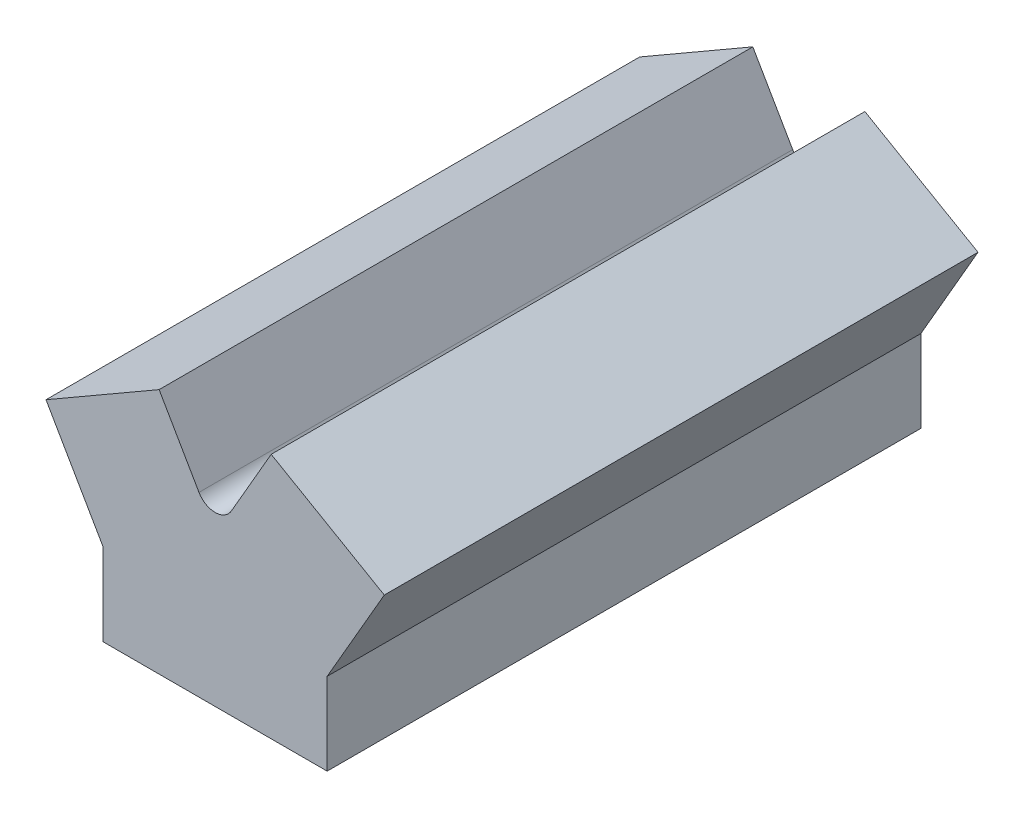
from build123d import *

# Parameters (mm, degrees)
BOSS_EXTRUDE1_DEPTH = 403.86
CUT_EXTRUDE2_START  = -25.4
CUT_EXTRUDE2_DEPTH  = 353.06
CUT_EXTRUDE5_START  = -19.05
SKETCH3_R           = 22.86
CUT_EXTRUDE5_DEPTH  = 353.06
CUT_EXTRUDE6_START  = -19.05
SKETCH4_R           = 22.86
CUT_EXTRUDE6_DEPTH  = 353.06
SKETCH5_R           = 5.715
CUT_EXTRUDE7_DEPTH  = 76.2


with BuildPart() as part:
    # Sketch1 → Boss-Extrude1 (new body)
    with BuildSketch(Plane.XY):
        with BuildLine():
            Line((-10.998522628, 120.65), (-38.114105889, 167.615567884))
            Line((-38.114105889, 167.615567884), (-115.061446619, 123.19))
            Line((-115.061446619, 123.19), (-76.2, 55.88))
            Line((-76.2, 55.88), (-76.2, 0))
            Line((-76.2, 0), (76.2, 0))
            Line((76.2, 0), (76.2, 55.88))
            Line((76.2, 55.88), (115.061446619, 123.19))
            Line((115.061446619, 123.19), (38.114105889, 167.615567884))
            Line((38.114105889, 167.615567884), (10.998522628, 120.65))
            ThreePointArc((10.998522628, 120.65), (0, 114.3), (-10.998522628, 120.65))
        make_face()
    extrude(amount=BOSS_EXTRUDE1_DEPTH)

    # Sketch2 → Cut-Extrude2 (cut)
    with BuildSketch(Plane.XY.offset(403.86).offset(CUT_EXTRUDE2_START)):
        with BuildLine():
            Line((26.311519178, 45.814017315), (50.8, 31.75))
            Line((50.8, 31.75), (50.8, 0))
            Line((50.8, 0), (-50.8, 0))
            Line((-50.8, 0), (-50.8, 31.75))
            Line((-50.8, 31.75), (-26.311519178, 45.814017315))
            ThreePointArc((-26.311519178, 45.814017315), (0, 52.832), (26.311519178, 45.814017315))
        make_face()
    extrude(amount=-CUT_EXTRUDE2_DEPTH, mode=Mode.SUBTRACT)

    # Sketch3 → Cut-Extrude5 (cut)
    with BuildSketch(Plane(origin=(82.108196401, 142.215567884, 0), x_dir=(0.8660254037844397, -0.4999999999999981, 0), z_dir=(0.4999999999999982, 0.8660254037844398, 0)).offset(CUT_EXTRUDE5_START)):
        with Locations(Location((0, -60.96, 0), (0, 0, 180))):
            Circle(SKETCH3_R)
        with Locations(Location((0, -172.72, 0), (0, 0, 180))):
            Circle(SKETCH3_R)
        with Locations(Location((0, -284.48, 0), (0, 0, 180))):
            Circle(SKETCH3_R)
    extrude(amount=-CUT_EXTRUDE5_DEPTH, mode=Mode.SUBTRACT)

    # Sketch4 → Cut-Extrude6 (cut)
    with BuildSketch(Plane(origin=(-82.108196401, 142.215567884, 0), x_dir=(0.866025403784438, 0.5000000000000011, 0), z_dir=(-0.5000000000000011, 0.8660254037844382, 0)).offset(CUT_EXTRUDE6_START)):
        with Locations(Location((0, -340.36, 0), (0, 0, 180))):
            Circle(SKETCH4_R)
        with Locations(Location((0, -228.6, 0), (0, 0, 180))):
            Circle(SKETCH4_R)
        with Locations(Location((0, -116.84, 0), (0, 0, 180))):
            Circle(SKETCH4_R)
    extrude(amount=-CUT_EXTRUDE6_DEPTH, mode=Mode.SUBTRACT)

    # Sketch5 → Cut-Extrude7 (cut)
    with BuildSketch(Plane.XZ):
        with Locations(Location((-63.5, 12.7, 0), (0, 0, 270))):
            Circle(SKETCH5_R)
        with Locations(Location((63.5, 391.16, 0), (0, 0, 270))):
            Circle(SKETCH5_R)
    extrude(amount=-CUT_EXTRUDE7_DEPTH, mode=Mode.SUBTRACT)


solid = part.part
